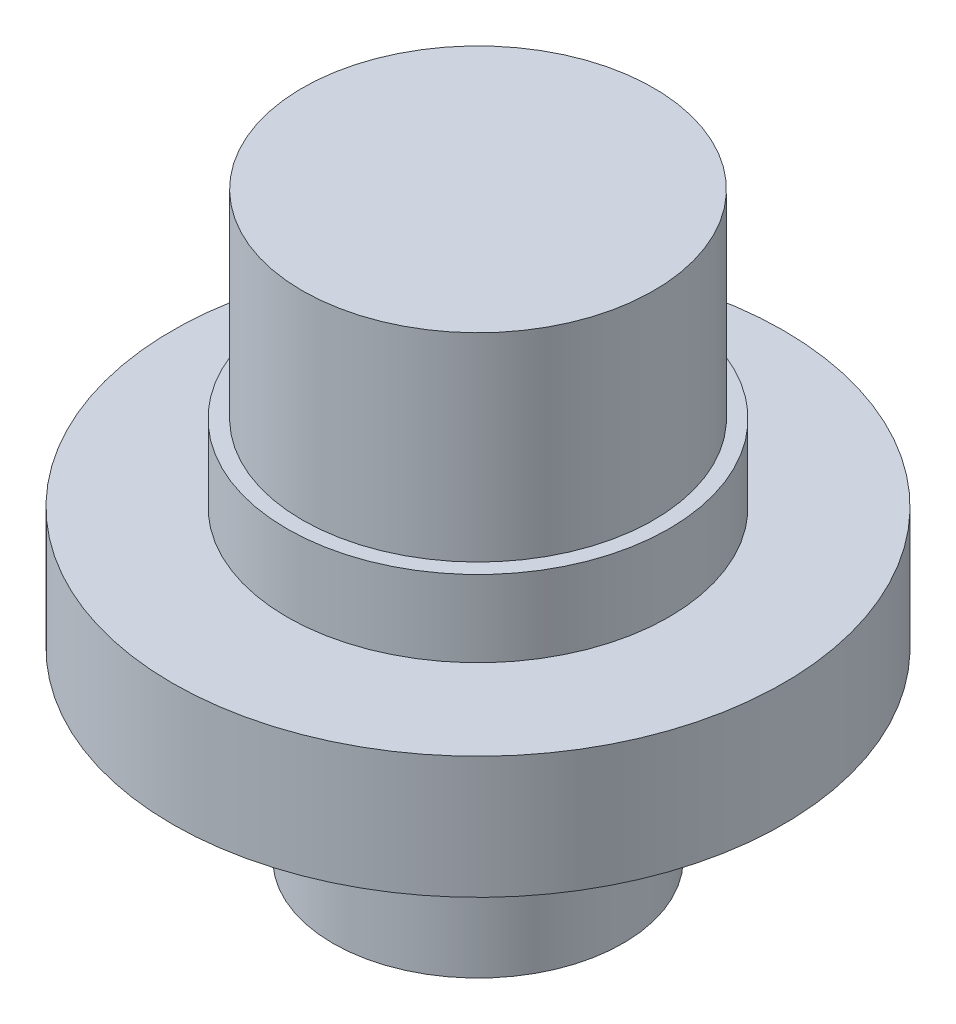
from build123d import *

# Parameters (mm, degrees)
SKETCH2_R           = 9.5
BOSS_EXTRUDE1_DEPTH = 12
SKETCH3_R           = 20
BOSS_EXTRUDE2_DEPTH = 8
SKETCH4_R           = 12.5
BOSS_EXTRUDE3_DEPTH = 5
SKETCH5_R           = 11.5
BOSS_EXTRUDE4_DEPTH = 13


with BuildPart() as part:
    # Sketch2 → Boss-Extrude1 (new body)
    with BuildSketch(Plane(origin=(0, 0, 0), x_dir=(1, 0, 0), z_dir=(0, 1, 0))):
        with Locations(Location((0, 0, 0), (0, 0, 270))):
            Circle(SKETCH2_R)
    extrude(amount=BOSS_EXTRUDE1_DEPTH)

    # Sketch3 → Boss-Extrude2 (add)
    with BuildSketch(Plane(origin=(0, 12, 0), x_dir=(1, 0, 0), z_dir=(0, 1, 0))):
        with Locations(Location((0, 0, 0), (0, 0, 270))):
            Circle(SKETCH3_R)
    extrude(amount=BOSS_EXTRUDE2_DEPTH)

    # Sketch4 → Boss-Extrude3 (add)
    with BuildSketch(Plane(origin=(0, 20, 0), x_dir=(1, 0, 0), z_dir=(0, 1, 0))):
        with Locations(Location((0, 0, 0), (0, 0, 270))):
            Circle(SKETCH4_R)
    extrude(amount=BOSS_EXTRUDE3_DEPTH)

    # Sketch5 → Boss-Extrude4 (add)
    with BuildSketch(Plane(origin=(0, 25, 0), x_dir=(1, 0, 0), z_dir=(0, 1, 0))):
        with Locations(Location((0, 0, 0), (0, 0, 270))):
            Circle(SKETCH5_R)
    extrude(amount=BOSS_EXTRUDE4_DEPTH)


solid = part.part
